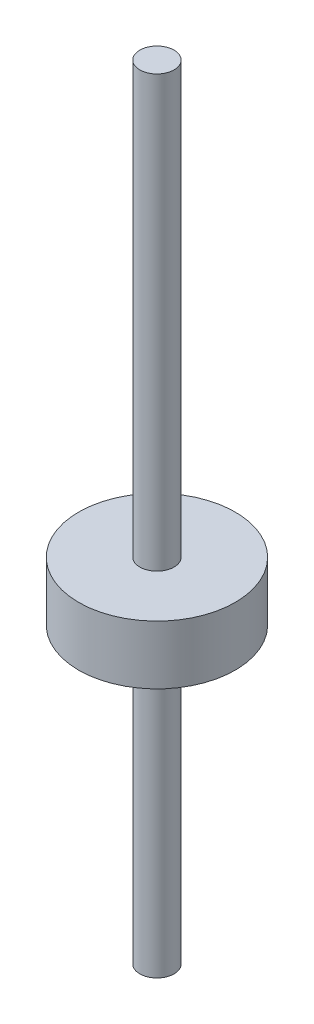
from build123d import *

# Parameters (mm, degrees)
SKETCH1_R           = 0.875
BOSS_EXTRUDE2_DEPTH = 18
SKETCH3_R           = 4
BOSS_EXTRUDE3_DEPTH = 3
SKETCH4_R           = 0.875
BOSS_EXTRUDE4_DEPTH = 22


with BuildPart() as part:
    # Sketch1 → Boss-Extrude2 (new body)
    with BuildSketch(Plane(origin=(0, 0, 0), x_dir=(1, 0, 0), z_dir=(0, 1, 0))):
        with Locations(Location((0, 0, 0), (0, 0, 270))):
            Circle(SKETCH1_R)
    extrude(amount=BOSS_EXTRUDE2_DEPTH)

    # Sketch3 → Boss-Extrude3 (add)
    with BuildSketch(Plane(origin=(0, 18, 0), x_dir=(1, 0, 0), z_dir=(0, 1, 0))):
        with Locations(Location((0, 0, 0), (0, 0, 270))):
            Circle(SKETCH3_R)
    extrude(amount=-BOSS_EXTRUDE3_DEPTH)

    # Sketch4 → Boss-Extrude4 (add)
    with BuildSketch(Plane(origin=(0, 18, 0), x_dir=(1, 0, 0), z_dir=(0, 1, 0))):
        with Locations(Location((0, 0, 0), (0, 0, 270))):
            Circle(SKETCH4_R)
    extrude(amount=BOSS_EXTRUDE4_DEPTH)


solid = part.part
